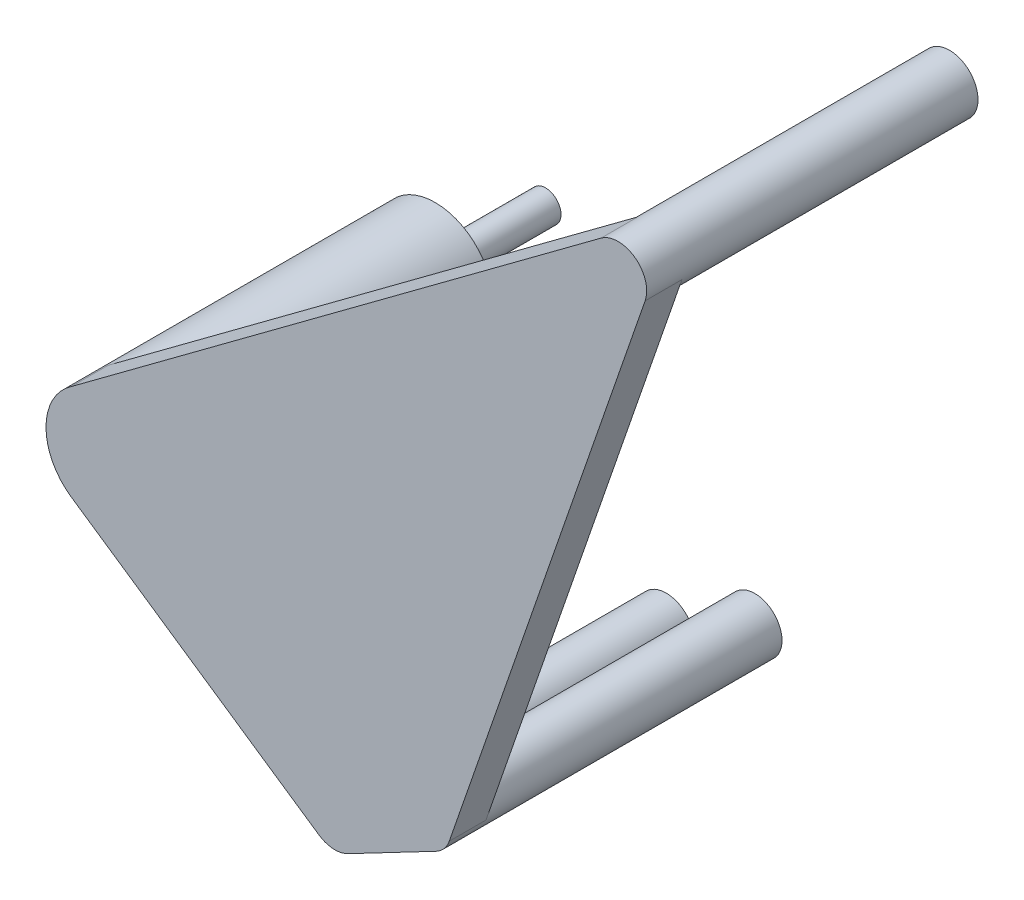
from build123d import *

# Parameters (mm, degrees)
SKETCH2_R             = 15
BOSS_EXTRUDE5_DEPTH   = 40.513
SKETCH2_R_2           = 7.343075537
BOSS_EXTRUDE5_2_DEPTH = 40.513
SKETCH2_R_3           = 7.048050761
BOSS_EXTRUDE5_3_DEPTH = 40.513
SKETCH2_R_4           = 7.405031705
BOSS_EXTRUDE5_4_DEPTH = 40.513
BOSS_EXTRUDE6_DEPTH   = 4.7625
SKETCH9_R             = 1.27
CUT_EXTRUDE2_DEPTH    = 9.525
SKETCH10_R            = 4
BOSS_EXTRUDE7_DEPTH   = 28.575


with BuildPart() as part:
    # Sketch2 → Boss-Extrude5 (new, symmetric)
    with BuildSketch(Plane.XY):
        with Locations((-135.989964622, 14.806967819)):
            Circle(SKETCH2_R)
    extrude(amount=BOSS_EXTRUDE5_DEPTH, both=True)



with BuildPart() as body_2:
    # Sketch2 → Boss-Extrude5 2 (new, symmetric)
    with BuildSketch(Plane.XY):
        with Locations((-76.175726851, -35.218198752)):
            Circle(SKETCH2_R_2)
    extrude(amount=BOSS_EXTRUDE5_2_DEPTH, both=True)


with BuildPart() as body_3:
    # Sketch2 → Boss-Extrude5 3 (new, symmetric)
    with BuildSketch(Plane.XY):
        with Locations((-53.236134933, -23.53725338)):
            Circle(SKETCH2_R_3)
    extrude(amount=BOSS_EXTRUDE5_3_DEPTH, both=True)


with BuildPart() as body_4:
    # Sketch2 → Boss-Extrude5 4 (new, symmetric)
    with BuildSketch(Plane.XY):
        with Locations((-2.84319901, 123.138021163)):
            Circle(SKETCH2_R_4)
    extrude(amount=BOSS_EXTRUDE5_4_DEPTH, both=True)


with BuildPart() as part_1:
    add(part.part)

    add(body_2.part)  # Boss-Extrude6 merges body 2

    add(body_3.part)  # Boss-Extrude6 merges body 3

    add(body_4.part)  # Boss-Extrude6 merges body 4
    # Sketch6 → Boss-Extrude6 (add, symmetric)
    with BuildSketch(Plane.XY.offset(40.513)):
        with BuildLine():
            Line((-144.43677034, 2.411344674), (-80.310762347, -41.286331891))
            ThreePointArc((-80.310762347, -41.286331891), (-76.600330476, -42.54898794), (-72.768932333, -41.723159126))
            Line((-72.768932333, -41.723159126), (-49.966216141, -29.780862162))
            ThreePointArc((-49.966216141, -29.780862162), (-47.894807622, -28.135648979), (-46.575803889, -25.842683907))
            Line((-46.575803889, -25.842683907), (4.15447513, 120.715821505))
            ThreePointArc((4.15447513, 120.715821505), (1.535064989, 129.110064273), (-7.258334859, 129.082856736))
            Line((-7.258334859, 129.082856736), (-144.43677034, 27.202590964))
            ThreePointArc((-144.43677034, 27.202590964), (-150.989964622, 14.806967819), (-144.43677034, 2.411344674))
        make_face()
    extrude(amount=BOSS_EXTRUDE6_DEPTH, both=True)

    # Sketch9 → Cut-Extrude2 (cut)
    with BuildSketch(Plane(origin=(0, 0, -40.513), x_dir=(-1, 0, 0), z_dir=(0, 0, -1))):
        with Locations((53.236134933, -23.53725338)):
            Circle(SKETCH9_R)
        with Locations((76.175726851, -35.218198752)):
            Circle(SKETCH9_R)
        with Locations((2.84319901, 123.138021163)):
            Circle(SKETCH9_R)
    extrude(amount=-CUT_EXTRUDE2_DEPTH, mode=Mode.SUBTRACT)

    # Sketch10 → Boss-Extrude7 (add)
    with BuildSketch(Plane(origin=(0, 0, -40.513), x_dir=(-1, 0, 0), z_dir=(0, 0, -1))):
        with Locations((135.989964622, 14.806967819)):
            Circle(SKETCH10_R)
    extrude(amount=BOSS_EXTRUDE7_DEPTH)


solid = part_1.part
